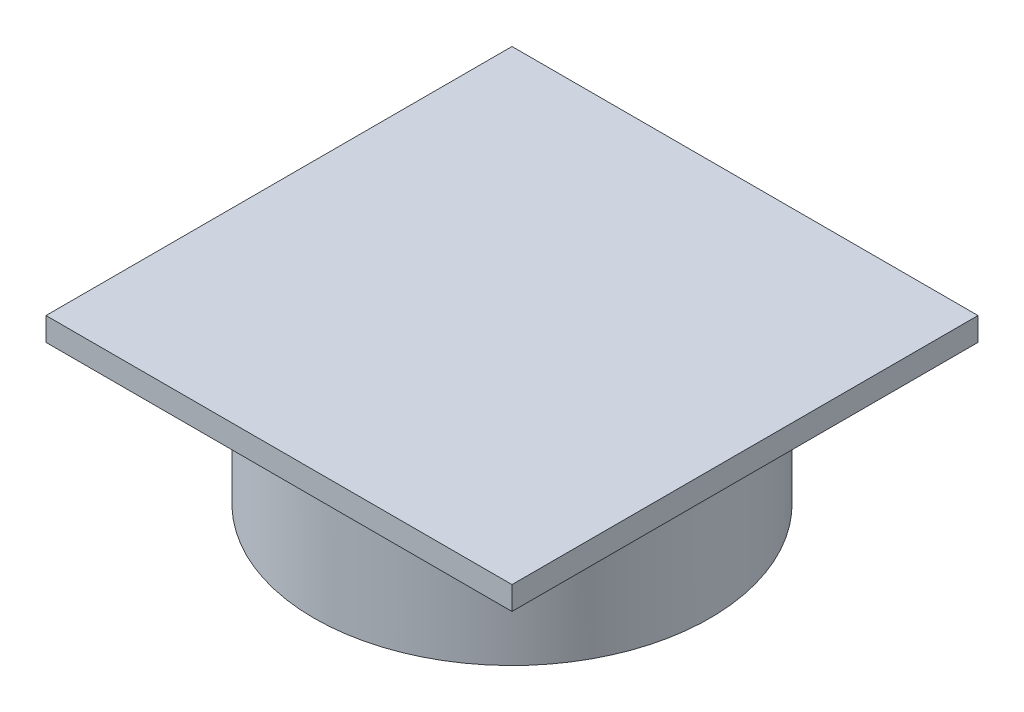
from build123d import *

# Parameters (mm, degrees)
CROQUIS1_R              = 42.5
SALIENTE_EXTRUIR1_DEPTH = 30
CROQUIS2_W              = 100
CROQUIS2_H              = 100
SALIENTE_EXTRUIR2_DEPTH = 5
REDONDEO1_R             = 5
CROQUIS3_R              = 2
CORTAR_EXTRUIR1_DEPTH   = 20


with BuildPart() as part:
    # Croquis1 → Saliente-Extruir1 (new body)
    with BuildSketch(Plane(origin=(0, 0, 0), x_dir=(1, 0, 0), z_dir=(0, 1, 0))):
        with Locations(Location((0, 0, 0), (0, 0, 270))):
            Circle(CROQUIS1_R)
    extrude(amount=SALIENTE_EXTRUIR1_DEPTH)

    # Croquis2 → Saliente-Extruir2 (add)
    with BuildSketch(Plane(origin=(0, 30, 0), x_dir=(1, 0, 0), z_dir=(0, 1, 0))):
        Rectangle(CROQUIS2_W, CROQUIS2_H)
    extrude(amount=SALIENTE_EXTRUIR2_DEPTH)

    # Redondeo1
    redondeo1_edges = [part.edges().sort_by_distance(p)[0] for p in [
        (0, 30, -42.5),
    ]]
    fillet(redondeo1_edges, radius=REDONDEO1_R)

    # Croquis3 → Cortar-Extruir1 (cut)
    with BuildSketch(Plane.XZ):
        with Locations(Location((-26.870057685, 26.870057685, 0), (0, 0, 270))):
            Circle(CROQUIS3_R)
        with Locations(Location((26.870057685, -26.870057685, 0), (0, 0, 90))):
            Circle(CROQUIS3_R)
    extrude(amount=-CORTAR_EXTRUIR1_DEPTH, mode=Mode.SUBTRACT)


solid = part.part
